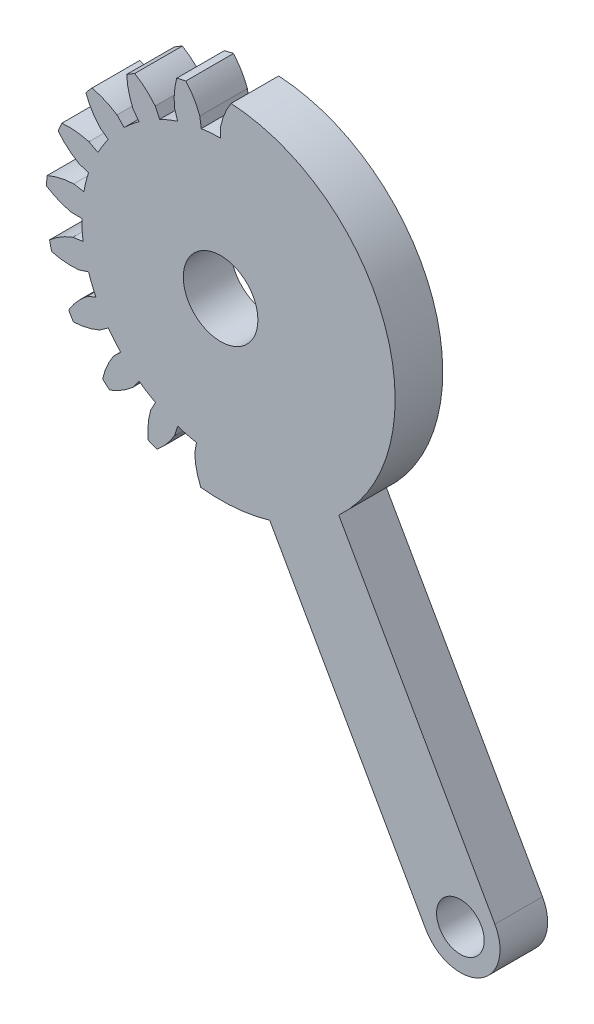
from build123d import *

# Parameters (mm, degrees)
EXTRUSION_DENTS_DEPTH         = 3
R_P_TITION_CIRCULAIRE2_COUNT  = 20
ESQUISSE1_R                   = 8.75
EXTRUSION_DISQUE_DEPTH        = 3
BOSS_EXTRU_1_DEPTH            = 3
ESQUISSE6_R                   = 1.5
BOSS_EXTRU_2_DEPTH            = 3
ESQUISSE3_R                   = 2.35
ENL_V_MAT_EXTRU_1_DEPTH       = 35.263364496
ESQUISSE8_R                   = 0.8
FIXATION_PALONNIER_SG90_DEPTH = 2.5


with BuildPart() as part:
    # Esquisse2 → Extrusion dents (new body)
    with BuildSketch(Plane.XY):
        with BuildLine():
            Line((0, 9.396926208), (0, 8.75))
            ThreePointArc((0, 8.75), (0.761630034, 8.716789529), (1.517478561, 8.617410215))
            Line((1.517478561, 8.617410215), (1.629672464, 9.254533474))
            ThreePointArc((1.629672464, 9.254533474), (1.517874028, 10.109272502), (1.250299377, 10.928712251))
            ThreePointArc((1.250299377, 10.928712251), (0.956235935, 10.958358127), (0.661482168, 10.980092957))
            ThreePointArc((0.661482168, 10.980092957), (0.25763458, 10.219055101), (0, 9.396926208))
        make_face()
    extrude(amount=EXTRUSION_DENTS_DEPTH)


with BuildPart() as r_p_tition_circulaire2_1:
    # Répétition circulaire2: pattern copy
    add(part.part.rotate(Axis((0, 0, 0), (0, 0, 1)), 1 * 360 / R_P_TITION_CIRCULAIRE2_COUNT))


with BuildPart() as r_p_tition_circulaire2_2:
    # Répétition circulaire2: pattern copy
    add(part.part.rotate(Axis((0, 0, 0), (0, 0, 1)), 2 * 360 / R_P_TITION_CIRCULAIRE2_COUNT))


with BuildPart() as r_p_tition_circulaire2_3:
    # Répétition circulaire2: pattern copy
    add(part.part.rotate(Axis((0, 0, 0), (0, 0, 1)), 3 * 360 / R_P_TITION_CIRCULAIRE2_COUNT))


with BuildPart() as r_p_tition_circulaire2_4:
    # Répétition circulaire2: pattern copy
    add(part.part.rotate(Axis((0, 0, 0), (0, 0, 1)), 4 * 360 / R_P_TITION_CIRCULAIRE2_COUNT))


with BuildPart() as r_p_tition_circulaire2_5:
    # Répétition circulaire2: pattern copy
    add(part.part.rotate(Axis((0, 0, 0), (0, 0, 1)), 5 * 360 / R_P_TITION_CIRCULAIRE2_COUNT))


with BuildPart() as r_p_tition_circulaire2_6:
    # Répétition circulaire2: pattern copy
    add(part.part.rotate(Axis((0, 0, 0), (0, 0, 1)), 6 * 360 / R_P_TITION_CIRCULAIRE2_COUNT))


with BuildPart() as r_p_tition_circulaire2_7:
    # Répétition circulaire2: pattern copy
    add(part.part.rotate(Axis((0, 0, 0), (0, 0, 1)), 7 * 360 / R_P_TITION_CIRCULAIRE2_COUNT))


with BuildPart() as r_p_tition_circulaire2_8:
    # Répétition circulaire2: pattern copy
    add(part.part.rotate(Axis((0, 0, 0), (0, 0, 1)), 8 * 360 / R_P_TITION_CIRCULAIRE2_COUNT))


with BuildPart() as r_p_tition_circulaire2_9:
    # Répétition circulaire2: pattern copy
    add(part.part.rotate(Axis((0, 0, 0), (0, 0, 1)), 9 * 360 / R_P_TITION_CIRCULAIRE2_COUNT))


with BuildPart() as r_p_tition_circulaire2_10:
    # Répétition circulaire2: pattern copy
    add(part.part.rotate(Axis((0, 0, 0), (0, 0, 1)), 10 * 360 / R_P_TITION_CIRCULAIRE2_COUNT))


with BuildPart() as r_p_tition_circulaire2_11:
    # Répétition circulaire2: pattern copy
    add(part.part.rotate(Axis((0, 0, 0), (0, 0, 1)), 11 * 360 / R_P_TITION_CIRCULAIRE2_COUNT))


with BuildPart() as r_p_tition_circulaire2_12:
    # Répétition circulaire2: pattern copy
    add(part.part.rotate(Axis((0, 0, 0), (0, 0, 1)), 12 * 360 / R_P_TITION_CIRCULAIRE2_COUNT))


with BuildPart() as r_p_tition_circulaire2_13:
    # Répétition circulaire2: pattern copy
    add(part.part.rotate(Axis((0, 0, 0), (0, 0, 1)), 13 * 360 / R_P_TITION_CIRCULAIRE2_COUNT))


with BuildPart() as r_p_tition_circulaire2_14:
    # Répétition circulaire2: pattern copy
    add(part.part.rotate(Axis((0, 0, 0), (0, 0, 1)), 14 * 360 / R_P_TITION_CIRCULAIRE2_COUNT))


with BuildPart() as r_p_tition_circulaire2_15:
    # Répétition circulaire2: pattern copy
    add(part.part.rotate(Axis((0, 0, 0), (0, 0, 1)), 15 * 360 / R_P_TITION_CIRCULAIRE2_COUNT))


with BuildPart() as r_p_tition_circulaire2_16:
    # Répétition circulaire2: pattern copy
    add(part.part.rotate(Axis((0, 0, 0), (0, 0, 1)), 16 * 360 / R_P_TITION_CIRCULAIRE2_COUNT))


with BuildPart() as r_p_tition_circulaire2_17:
    # Répétition circulaire2: pattern copy
    add(part.part.rotate(Axis((0, 0, 0), (0, 0, 1)), 17 * 360 / R_P_TITION_CIRCULAIRE2_COUNT))


with BuildPart() as r_p_tition_circulaire2_18:
    # Répétition circulaire2: pattern copy
    add(part.part.rotate(Axis((0, 0, 0), (0, 0, 1)), 18 * 360 / R_P_TITION_CIRCULAIRE2_COUNT))


with BuildPart() as r_p_tition_circulaire2_19:
    # Répétition circulaire2: pattern copy
    add(part.part.rotate(Axis((0, 0, 0), (0, 0, 1)), 19 * 360 / R_P_TITION_CIRCULAIRE2_COUNT))


with BuildPart() as part_1:
    add(part.part)

    add(r_p_tition_circulaire2_1.part)  # Extrusion disque merges Répétition circulaire2_1

    add(r_p_tition_circulaire2_2.part)  # Extrusion disque merges Répétition circulaire2_2

    add(r_p_tition_circulaire2_3.part)  # Extrusion disque merges Répétition circulaire2_3

    add(r_p_tition_circulaire2_4.part)  # Extrusion disque merges Répétition circulaire2_4

    add(r_p_tition_circulaire2_5.part)  # Extrusion disque merges Répétition circulaire2_5

    add(r_p_tition_circulaire2_6.part)  # Extrusion disque merges Répétition circulaire2_6

    add(r_p_tition_circulaire2_7.part)  # Extrusion disque merges Répétition circulaire2_7

    add(r_p_tition_circulaire2_8.part)  # Extrusion disque merges Répétition circulaire2_8

    add(r_p_tition_circulaire2_9.part)  # Extrusion disque merges Répétition circulaire2_9

    add(r_p_tition_circulaire2_10.part)  # Extrusion disque merges Répétition circulaire2_10

    add(r_p_tition_circulaire2_11.part)  # Extrusion disque merges Répétition circulaire2_11

    add(r_p_tition_circulaire2_12.part)  # Extrusion disque merges Répétition circulaire2_12

    add(r_p_tition_circulaire2_13.part)  # Extrusion disque merges Répétition circulaire2_13

    add(r_p_tition_circulaire2_14.part)  # Extrusion disque merges Répétition circulaire2_14

    add(r_p_tition_circulaire2_15.part)  # Extrusion disque merges Répétition circulaire2_15

    add(r_p_tition_circulaire2_16.part)  # Extrusion disque merges Répétition circulaire2_16

    add(r_p_tition_circulaire2_17.part)  # Extrusion disque merges Répétition circulaire2_17

    add(r_p_tition_circulaire2_18.part)  # Extrusion disque merges Répétition circulaire2_18

    add(r_p_tition_circulaire2_19.part)  # Extrusion disque merges Répétition circulaire2_19
    # Esquisse1 → Extrusion disque (add)
    with BuildSketch(Plane.XY):
        Circle(ESQUISSE1_R)
    extrude(amount=EXTRUSION_DISQUE_DEPTH)

    # Esquisse5 → Boss.-Extru.1 (add)
    with BuildSketch(Plane(origin=(0, 0, 0), x_dir=(-1, 0, 0), z_dir=(0, 0, -1))):
        with BuildLine():
            Line((-0.957126431, 10.958280385), (0.957449481, -10.958252164))
            ThreePointArc((0.957449481, -10.958252164), (-10.958266276, -0.957287956), (-0.957126431, 10.958280385))
        make_face()
    extrude(amount=-BOSS_EXTRU_1_DEPTH)

    # Esquisse6 → Boss.-Extru.2 (add)
    with BuildSketch(Plane(origin=(0, 0, 0), x_dir=(-1, 0, 0), z_dir=(0, 0, -1))):
        with BuildLine():
            Line((-7.447050229, -8.095766974), (-17.287454672, -25.507442378))
            ThreePointArc((-17.287454672, -25.507442378), (-16.341045802, -28.913952359), (-12.934535821, -27.967543489))
            Line((-12.934535821, -27.967543489), (-3.094131377, -10.555868085))
            ThreePointArc((-3.094131377, -10.555868085), (-5.412222444, -9.576421473), (-7.447050229, -8.095766974))
        make_face()
        with Locations((-15.110995246, -26.737492934)):
            Circle(ESQUISSE6_R, mode=Mode.SUBTRACT)
    extrude(amount=-BOSS_EXTRU_2_DEPTH)

    # Esquisse3 → Enlèv. mat.-Extru.1 (cut, through all)
    with BuildSketch(Plane.XY.offset(3)):
        Circle(ESQUISSE3_R)
    extrude(amount=-ENL_V_MAT_EXTRU_1_DEPTH, mode=Mode.SUBTRACT)

    # Esquisse8 → Fixation palonnier SG90 (cut)
    with BuildSketch(Plane.XY):
        with Locations((-1.63779007, 5.040599536)):
            Circle(ESQUISSE8_R)
        with Locations((-5.3, 0)):
            Circle(ESQUISSE8_R)
        with Locations((-1.63779007, -5.040599536)):
            Circle(ESQUISSE8_R)
        with Locations((4.28779007, 3.115261837)):
            Circle(ESQUISSE8_R)
        with Locations((4.28779007, -3.115261837)):
            Circle(ESQUISSE8_R)
    extrude(amount=FIXATION_PALONNIER_SG90_DEPTH, mode=Mode.SUBTRACT)


solid = part_1.part
